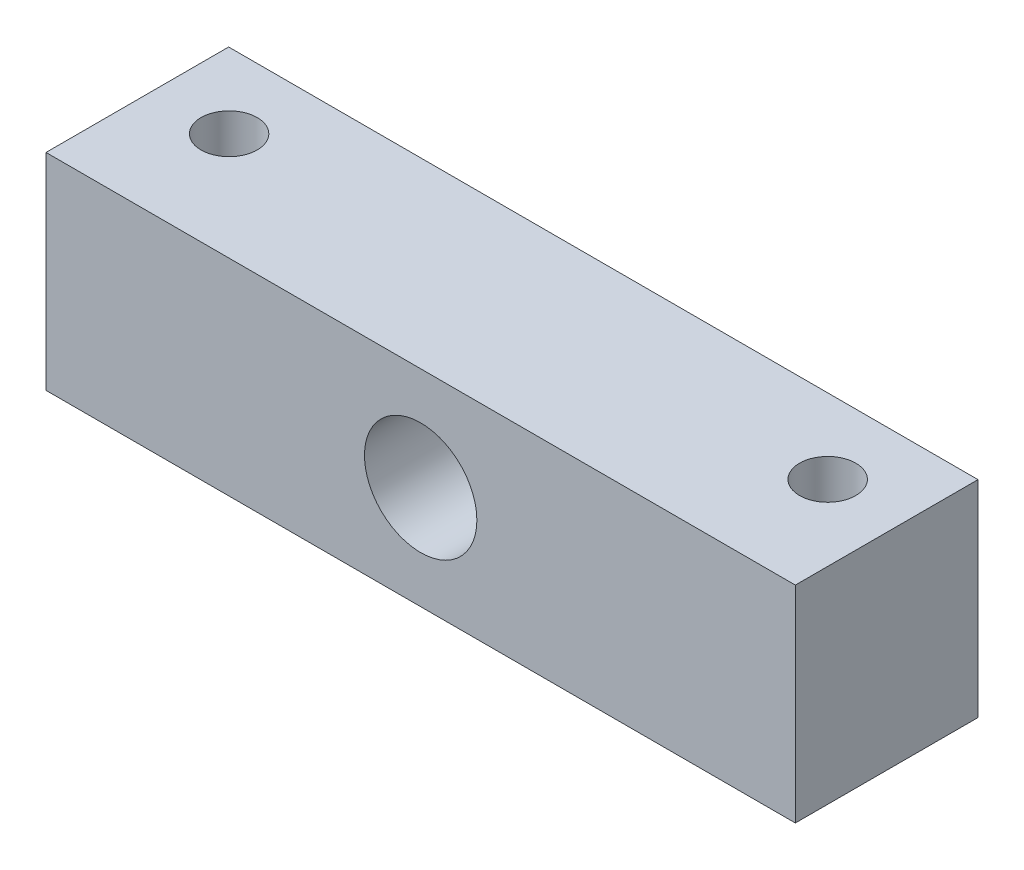
from build123d import *

# Parameters (mm, degrees)
SKETCH1_W           = 40
SKETCH1_H           = 9.75
SKETCH1_R           = 1.5
BOSS_EXTRUDE1_DEPTH = 11
CUT_EXTRUDE1_REACH  = 26.821


with BuildPart() as part:
    # Sketch1 → Boss-Extrude1 (new body)
    with BuildSketch(Plane(origin=(0, 0, 0), x_dir=(1, 0, 0), z_dir=(0, 1, 0))):
        Rectangle(SKETCH1_W, SKETCH1_H)
        with Locations(Location((-15.976056303, 0.875, 0), (0, 0, 270))):
            Circle(SKETCH1_R, mode=Mode.SUBTRACT)
        with Locations(Location((15.976056303, 0.875, 0), (0, 0, 90))):
            Circle(SKETCH1_R, mode=Mode.SUBTRACT)
    extrude(amount=BOSS_EXTRUDE1_DEPTH)

    # Sketch2 → Cut-Extrude1 (cut, up to next)
    with BuildSketch(Plane.XY.offset(4.875), mode=Mode.PRIVATE) as cut_extrude1_sk1:
        with BuildLine():
            ThreePointArc((3, 5.5), (2.121320344, 7.621320344), (0, 8.5))
            Line((0, 8.5), (0, 2.5))
            ThreePointArc((0, 2.5), (2.121320344, 3.378679656), (3, 5.5))
        make_face()
    cut_extrude1_tool1 = extrude(cut_extrude1_sk1.sketch, amount=-CUT_EXTRUDE1_REACH, mode=Mode.PRIVATE) & part.part
    # Sketch2 → Cut-Extrude1 (cut, up to next)
    with BuildSketch(Plane.XY.offset(4.875), mode=Mode.PRIVATE) as cut_extrude1_sk2:
        with BuildLine():
            Line((0, 2.5), (0, 8.5))
            ThreePointArc((0, 8.5), (-3, 5.5), (0, 2.5))
        make_face()
    cut_extrude1_tool2 = extrude(cut_extrude1_sk2.sketch, amount=-CUT_EXTRUDE1_REACH, mode=Mode.PRIVATE) & part.part
    # Sketch2 → Cut-Extrude1 (cut, up to next)
    with BuildSketch(Plane.XY.offset(4.875), mode=Mode.PRIVATE) as cut_extrude1_sk3:
        with BuildLine():
            ThreePointArc((3, 5.5), (2.121320344, 7.621320344), (0, 8.5))
            Line((0, 8.5), (0, 2.5))
            ThreePointArc((0, 2.5), (2.121320344, 3.378679656), (3, 5.5))
        make_face()
    cut_extrude1_tool3 = extrude(cut_extrude1_sk3.sketch, amount=-CUT_EXTRUDE1_REACH, mode=Mode.PRIVATE) & part.part
    # Sketch2 → Cut-Extrude1 (cut, up to next)
    with BuildSketch(Plane.XY.offset(4.875), mode=Mode.PRIVATE) as cut_extrude1_sk4:
        with BuildLine():
            Line((0, 2.5), (0, 8.5))
            ThreePointArc((0, 8.5), (-3, 5.5), (0, 2.5))
        make_face()
    cut_extrude1_tool4 = extrude(cut_extrude1_sk4.sketch, amount=-CUT_EXTRUDE1_REACH, mode=Mode.PRIVATE) & part.part
    add(cut_extrude1_tool1.solids().sort_by_distance((1.27324, 5.5, 4.875))[0], mode=Mode.SUBTRACT)
    add(cut_extrude1_tool2.solids().sort_by_distance((-1.27324, 5.5, 4.875))[0], mode=Mode.SUBTRACT)
    add(cut_extrude1_tool3.solids().sort_by_distance((1.27324, 5.5, 4.875))[0], mode=Mode.SUBTRACT)
    add(cut_extrude1_tool4.solids().sort_by_distance((-1.27324, 5.5, 4.875))[0], mode=Mode.SUBTRACT)


solid = part.part
